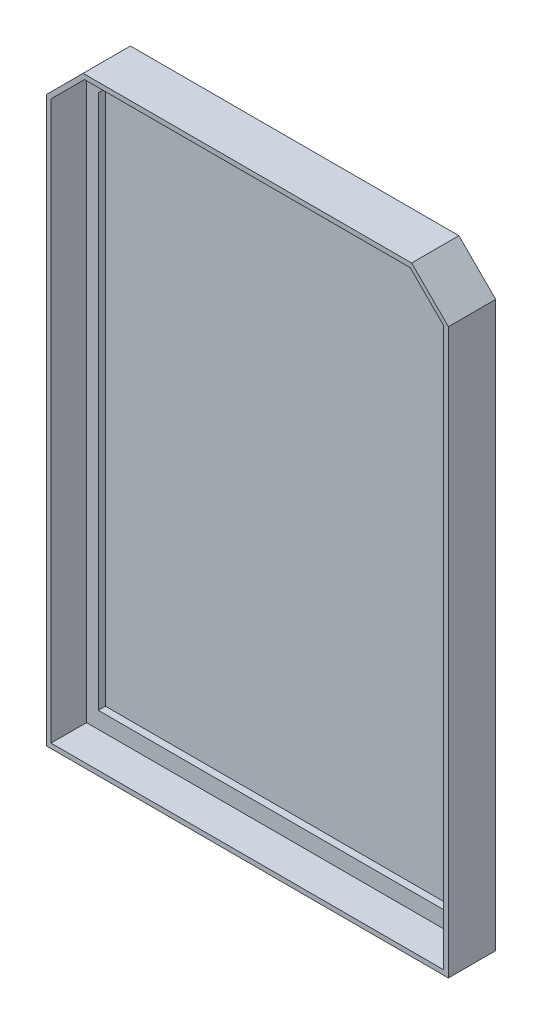
from build123d import *

# Parameters (mm, degrees)
BOSS_EXTRUDE1_DEPTH = 1.5
BOSS_EXTRUDE2_DEPTH = 9
BOSS_EXTRUDE3_DEPTH = 1
SKETCH4_R           = 5
SKETCH4_R_2         = 4
BOSS_EXTRUDE4_DEPTH = 10
FILLET1_R           = 5


with BuildPart() as part:
    # Sketch1 → Boss-Extrude1 (new body)
    with BuildSketch(Plane(origin=(0, 0, 0), x_dir=(0, 1, 0), z_dir=(0, 0, 1))):
        Polygon((-62.5, -41.5), (-62.5, 41.5), (55.428932188, 41.5), (62.5, 34.428932188), (62.5, -34.428932188), (55.428932188, -41.5), align=None)
        Polygon((54.050252532, 39), (59, 34.050252532), (59, -34.050252532), (54.050252532, -39), (-59, -39), (-59, 39), align=None, mode=Mode.SUBTRACT)
    extrude(amount=BOSS_EXTRUDE1_DEPTH)

    # Sketch2 → Boss-Extrude2 (add)
    with BuildSketch(Plane(origin=(0, 0, 0), x_dir=(0, 1, 0), z_dir=(0, 0, 1))):
        Polygon((-63.5, 42.5), (-63.5, -42.5), (55.721825407, -42.5), (63.5, -34.721825407), (63.5, 34.721825407), (55.721825407, 42.5), align=None)
        Polygon((-62.5, -41.5), (55.428932188, -41.5), (62.5, -34.428932188), (62.5, 34.428932188), (55.428932188, 41.5), (-62.5, 41.5), align=None, mode=Mode.SUBTRACT)
    extrude(amount=BOSS_EXTRUDE2_DEPTH)

    # Sketch3 → Boss-Extrude3 (add)
    with BuildSketch(Plane(origin=(0, 0, 0), x_dir=(0, 1, 0), z_dir=(0, 0, 1))):
        Polygon((63.5, 34.721825407), (55.721825407, 42.5), (-63.5, 42.5), (-63.5, -42.5), (55.721825407, -42.5), (63.5, -34.721825407), align=None)
    extrude(amount=-BOSS_EXTRUDE3_DEPTH)

    # Sketch4 → Boss-Extrude4 (add)
    with BuildSketch(Plane(origin=(0, 0, -1), x_dir=(1, 0, 0), z_dir=(0, 0, -1))):
        Circle(SKETCH4_R)
        with Locations(Location((0, 0, 0), (0, 0, 180))):
            Circle(SKETCH4_R_2, mode=Mode.SUBTRACT)
    extrude(amount=BOSS_EXTRUDE4_DEPTH)

    # Fillet1
    fillet1_edges = [part.edges().sort_by_distance(p)[0] for p in [
        (-5, 0, -1),
    ]]
    fillet(fillet1_edges, radius=FILLET1_R)


solid = part.part
